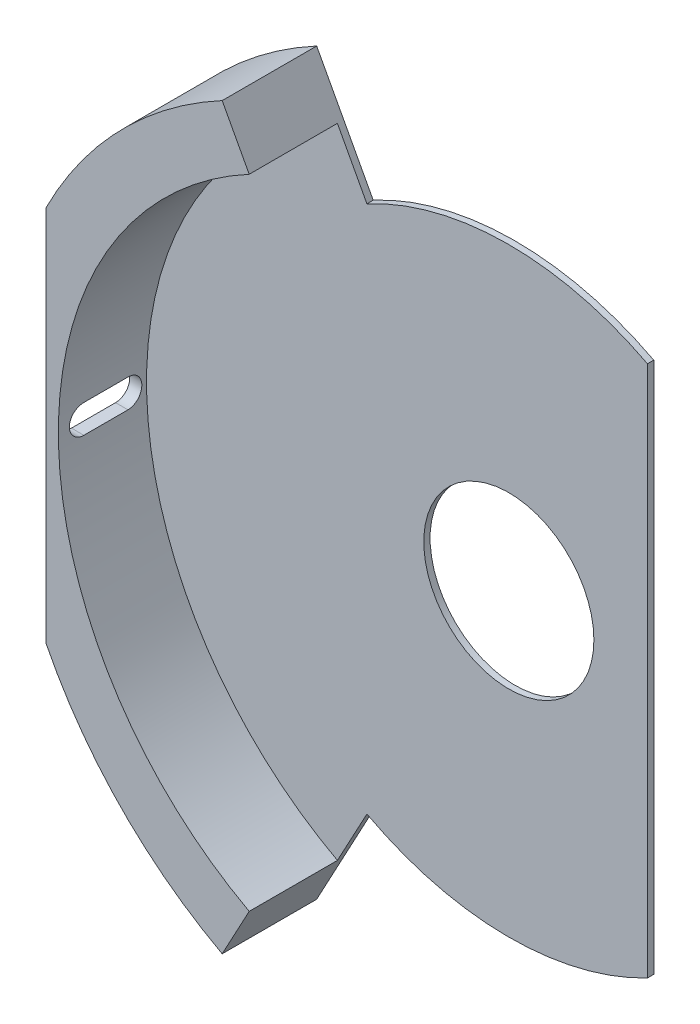
from build123d import *

# Parameters (mm, degrees)
SKETCH1_W               = 62.4208
SKETCH1_H               = 60
SKETCH1_R               = 13.5
BOSS_EXTRUDE1_DEPTH     = 1
BOSS_EXTRUDE2_START     = -1
SKETCH2_W               = 53.9308
SKETCH2_H               = 4.6
BOSS_EXTRUDE2_DEPTH     = 7
BOSS_EXTRUDE3_DEPTH     = 14
BOSS_EXTRUDE4_DEPTH     = 1
CUT_EXTRUDE1_REACH      = 103.509
CUT_EXTRUDE1_END_RADIUS = 57.5


with BuildPart() as part:
    # Sketch1 → Boss-Extrude1 (new body)
    with BuildSketch(Plane.XY):
        with Locations((6.283906244, 0.094262462)):
            Rectangle(SKETCH1_W, SKETCH1_H)
        with Locations((15.494306244, 0.094262462)):
            Circle(SKETCH1_R, mode=Mode.SUBTRACT)
    extrude(amount=BOSS_EXTRUDE1_DEPTH)

    # Sketch2 → Boss-Extrude2 (add)
    with BuildSketch(Plane.XY.offset(1).offset(BOSS_EXTRUDE2_START)):
        with Locations((2.038906244, -27.605737538)):
            Rectangle(SKETCH2_W, SKETCH2_H)
        with Locations((2.038906244, 27.794262462)):
            Rectangle(SKETCH2_W, SKETCH2_H)
    extrude(amount=-BOSS_EXTRUDE2_DEPTH)



with BuildPart() as body_2:
    # Sketch3 → Boss-Extrude3 (new body)
    with BuildSketch(Plane.XY.offset(1)):
        with BuildLine():
            ThreePointArc((-33.559235932, 30.094262462), (-24.010484349, 41.87489817), (-11.714027053, 50.749534638))
            Line((-11.714027053, 50.749534638), (-16.003239131, 58.735000077))
            ThreePointArc((-16.003239131, 58.735000077), (-32.167096843, 46.561693298), (-43.926493756, 30.094262462))
            Line((-43.926493756, 30.094262462), (-33.559235932, 30.094262462))
        make_face()
        with BuildLine():
            Line((-43.926493756, -29.905737538), (-33.559235932, -29.905737538))
            ThreePointArc((-33.559235932, -29.905737538), (-42.005693756, 0.094262462), (-33.559235932, 30.094262462))
            Line((-33.559235932, 30.094262462), (-43.926493756, 30.094262462))
            Line((-43.926493756, 30.094262462), (-43.926493756, -29.905737538))
        make_face()
        with BuildLine():
            Line((-16.003239131, -58.546475153), (-11.714027053, -50.561009713))
            ThreePointArc((-11.714027053, -50.561009713), (-24.010484349, -41.686373246), (-33.559235932, -29.905737538))
            Line((-33.559235932, -29.905737538), (-43.926493756, -29.905737538))
            ThreePointArc((-43.926493756, -29.905737538), (-32.167096843, -46.373168373), (-16.003239131, -58.546475153))
        make_face()
    extrude(amount=BOSS_EXTRUDE3_DEPTH)


with BuildPart() as part_1:
    add(part.part)

    add(body_2.part)  # Boss-Extrude4 merges body 2
    # Sketch4 → Boss-Extrude4 (add)
    with BuildSketch(Plane.XY.offset(1)):
        with BuildLine():
            Line((37.494306244, -42.119641485), (37.494306244, -29.905737538))
            Line((37.494306244, -29.905737538), (-24.926493756, -29.905737538))
            Line((-24.926493756, -29.905737538), (-24.926493756, 30.094262462))
            Line((-24.926493756, 30.094262462), (37.494306244, 30.094262462))
            Line((37.494306244, 30.094262462), (37.494306244, 42.30816641))
            ThreePointArc((37.494306244, 42.30816641), (15.197309329, 47.696000659), (-7.030722747, 42.030365708))
            Line((-7.030722747, 42.030365708), (-16.003239131, 58.735000077))
            ThreePointArc((-16.003239131, 58.735000077), (-32.167096843, 46.561693298), (-43.926493756, 30.094262462))
            Line((-43.926493756, 30.094262462), (-43.926493756, -29.905737538))
            ThreePointArc((-43.926493756, -29.905737538), (-32.167096843, -46.373168373), (-16.003239131, -58.546475153))
            Line((-16.003239131, -58.546475153), (-7.030722747, -41.841840784))
            ThreePointArc((-7.030722747, -41.841840784), (15.197309329, -47.507475734), (37.494306244, -42.119641485))
        make_face()
    extrude(amount=-BOSS_EXTRUDE4_DEPTH)

    # Cut-Extrude1: up to this cylinder (the profile starts outside it)
    cut_extrude1_end = Plane(origin=(15.494306244, 0.094262462, 7.5), z_dir=(0, 0, -1)) * Cylinder(CUT_EXTRUDE1_END_RADIUS, 323.018, mode=Mode.PRIVATE)
    # Sketch5 → Cut-Extrude1 (cut, up to the surface)
    with BuildSketch(Plane.ZY.offset(43.926493756), mode=Mode.PRIVATE) as cut_extrude1_sk1:
        with BuildLine():
            Line((4, 2.25), (11, 2.25))
            ThreePointArc((11, 2.25), (13.25, 0), (11, -2.25))
            Line((11, -2.25), (4, -2.25))
            ThreePointArc((4, -2.25), (1.75, 0), (4, 2.25))
        make_face()
    cut_extrude1_tool1 = extrude(cut_extrude1_sk1.sketch, amount=-CUT_EXTRUDE1_REACH, mode=Mode.PRIVATE) - cut_extrude1_end
    add(cut_extrude1_tool1.solids().sort_by_distance((-43.926494, 0, 7.5))[0], mode=Mode.SUBTRACT)


solid = part_1.part
